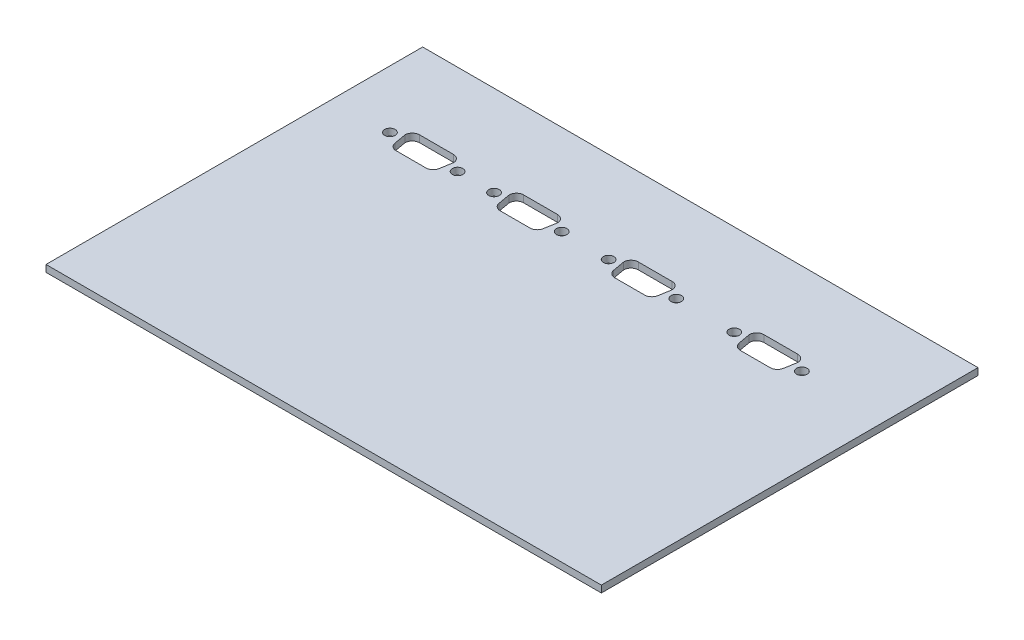
from build123d import *

# Parameters (mm, degrees)
SKETCH1_W           = 205.16159644
SKETCH1_H           = 139.144251052
BOSS_EXTRUDE1_DEPTH = 2.54
SKETCH3_R           = 1.9304
CUT_EXTRUDE1_DEPTH  = 124.973998942


with BuildPart() as part:
    # Sketch1 → Boss-Extrude1 (new body)
    with BuildSketch(Plane(origin=(0, 0, 0), x_dir=(1, 0, 0), z_dir=(0, 1, 0))):
        Rectangle(SKETCH1_W, SKETCH1_H)
    extrude(amount=BOSS_EXTRUDE1_DEPTH)

    # Sketch3 → Cut-Extrude1 (cut, through all)
    with BuildSketch(Plane(origin=(0, 2.54, 0), x_dir=(1, 0, 0), z_dir=(0, 1, 0))):
        with Locations(Location((-81.293768085, 36.19177457, 0), (0, 0, 270))):
            Circle(SKETCH3_R)
        with Locations(Location((-56.300168085, 36.19177457, 0), (0, 0, 270))):
            Circle(SKETCH3_R)
        with Locations(Location((-42.832492591, 36.19177457, 0), (0, 0, 270))):
            Circle(SKETCH3_R)
        with Locations(Location((-17.838892591, 36.19177457, 0), (0, 0, 270))):
            Circle(SKETCH3_R)
        with Locations(Location((-0.229233582, 35.924108913, 0), (0, 0, 270))):
            Circle(SKETCH3_R)
        with Locations(Location((24.764366418, 35.924108913, 0), (0, 0, 270))):
            Circle(SKETCH3_R)
        with Locations(Location((46.220152976, 35.873923159, 0), (0, 0, 270))):
            Circle(SKETCH3_R)
        with Locations(Location((71.213752976, 35.873923159, 0), (0, 0, 270))):
            Circle(SKETCH3_R)
        with BuildLine():
            Line((-62.535868085, 40.90347457), (-75.058068085, 40.90347457))
            ThreePointArc((-75.058068085, 40.90347457), (-76.969282019, 40.096622494), (-77.724090306, 38.164262946))
            Line((-77.724090306, 38.164262946), (-76.934091112, 33.68395488))
            ThreePointArc((-76.934091112, 33.68395488), (-76.02192339, 32.10403404), (-74.307608835, 31.48007457))
            Line((-74.307608835, 31.48007457), (-63.286327336, 31.48007457))
            ThreePointArc((-63.286327336, 31.48007457), (-61.572012781, 32.10403404), (-60.659845059, 33.68395488))
            Line((-60.659845059, 33.68395488), (-59.869845865, 38.164262946))
            ThreePointArc((-59.869845865, 38.164262946), (-60.624654152, 40.096622494), (-62.535868085, 40.90347457))
        make_face()
        with BuildLine():
            Line((-24.074592591, 40.90347457), (-36.596792591, 40.90347457))
            ThreePointArc((-36.596792591, 40.90347457), (-38.508006525, 40.096622494), (-39.262814812, 38.164262946))
            Line((-39.262814812, 38.164262946), (-38.472815618, 33.68395488))
            ThreePointArc((-38.472815618, 33.68395488), (-37.560647896, 32.10403404), (-35.846333341, 31.48007457))
            Line((-35.846333341, 31.48007457), (-24.825051842, 31.48007457))
            ThreePointArc((-24.825051842, 31.48007457), (-23.110737287, 32.10403404), (-22.198569565, 33.68395488))
            Line((-22.198569565, 33.68395488), (-21.408570371, 38.164262946))
            ThreePointArc((-21.408570371, 38.164262946), (-22.163378658, 40.096622494), (-24.074592591, 40.90347457))
        make_face()
        with BuildLine():
            Line((18.528666418, 40.635808913), (6.006466418, 40.635808913))
            ThreePointArc((6.006466418, 40.635808913), (4.095252484, 39.828956838), (3.340444197, 37.89659729))
            Line((3.340444197, 37.89659729), (4.130443391, 33.416289223))
            ThreePointArc((4.130443391, 33.416289223), (5.042611113, 31.836368383), (6.756925668, 31.212408913))
            Line((6.756925668, 31.212408913), (17.778207167, 31.212408913))
            ThreePointArc((17.778207167, 31.212408913), (19.492521722, 31.836368383), (20.404689444, 33.416289223))
            Line((20.404689444, 33.416289223), (21.194688638, 37.89659729))
            ThreePointArc((21.194688638, 37.89659729), (20.439880351, 39.828956838), (18.528666418, 40.635808913))
        make_face()
        with BuildLine():
            Line((64.978052976, 40.585623159), (52.455852976, 40.585623159))
            ThreePointArc((52.455852976, 40.585623159), (50.544639042, 39.778771083), (49.789830755, 37.846411536))
            Line((49.789830755, 37.846411536), (50.579829949, 33.366103469))
            ThreePointArc((50.579829949, 33.366103469), (51.491997671, 31.786182629), (53.206312227, 31.162223159))
            Line((53.206312227, 31.162223159), (64.227593725, 31.162223159))
            ThreePointArc((64.227593725, 31.162223159), (65.94190828, 31.786182629), (66.854076003, 33.366103469))
            Line((66.854076003, 33.366103469), (67.644075197, 37.846411536))
            ThreePointArc((67.644075197, 37.846411536), (66.88926691, 39.778771083), (64.978052976, 40.585623159))
        make_face()
    extrude(amount=-CUT_EXTRUDE1_DEPTH, mode=Mode.SUBTRACT)


solid = part.part
